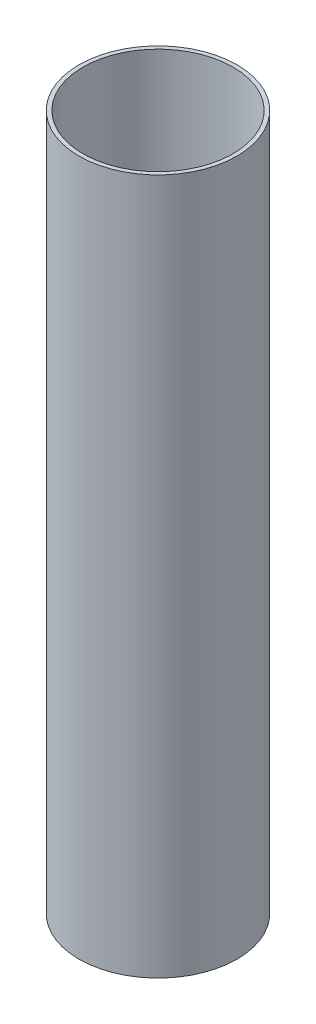
from build123d import *

# Parameters (mm, degrees)
SKETCH1_W = 3.175
SKETCH1_H = 558.8


with BuildPart() as part:
    # Sketch1 → Revolve1 (revolve)
    with BuildSketch(Plane.XY, mode=Mode.PRIVATE) as revolve1_sk:
        with Locations((61.9125, 279.4)):
            Rectangle(SKETCH1_W, SKETCH1_H)
    revolve(revolve1_sk.sketch.rotate(Axis((0, 0, 0), (0, 1, 0)), 90), axis=Axis((0, 0, 0), (0, 1, 0)))


solid = part.part
